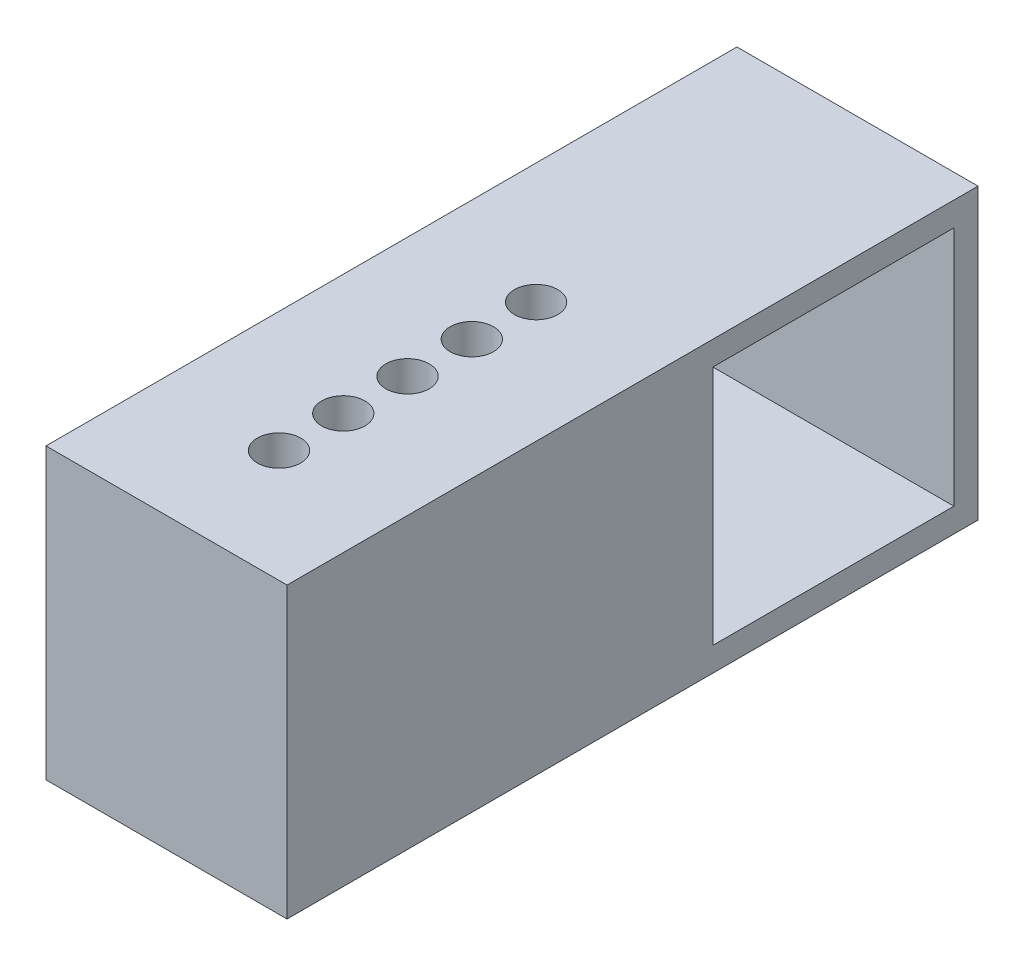
from build123d import *

# Parameters (mm, degrees)
SCHIZZO1_W                    = 25
SCHIZZO1_H                    = 18
SCHIZZO1_W_2                  = 18
SCHIZZO1_W_3                  = 15
SCHIZZO1_H_2                  = 15
ESTRUSIONE_ESTRUSIONE1_DEPTH  = 15
TAGLIO_ESTRUSIONE1_DEPTH      = 42.291645644
TAGLIO_ESTRUSIONE1_DEPTH_BACK = 42.291645644
SCHIZZO2_R                    = 1.35
SCHIZZO3_R                    = 1.35
TAGLIO_ESTRUSIONE2_DEPTH      = 15
SCHIZZO4_R                    = 1.35
TAGLIO_ESTRUSIONE3_DEPTH      = 15


with BuildPart() as part:
    # Schizzo1 → Estrusione-Estrusione1 (new body)
    # profile 1 of 2: a face of its own
    with BuildSketch(Plane(origin=(0, 0, 0), x_dir=(0, 0, -1), z_dir=(1, 0, 0))):
        with Locations((-21.5, 0)):
            Rectangle(SCHIZZO1_W, SCHIZZO1_H)
    # profile 2 of 2: a face of its own
    with BuildSketch(Plane(origin=(0, 0, 0), x_dir=(0, 0, -1), z_dir=(1, 0, 0))):
        Rectangle(SCHIZZO1_W_2, SCHIZZO1_H)
        Rectangle(SCHIZZO1_W_3, SCHIZZO1_H_2, mode=Mode.SUBTRACT)
    extrude(amount=ESTRUSIONE_ESTRUSIONE1_DEPTH)

    # Schizzo2 → Taglio-Estrusione1 (cut, two sides: drawn at the far end of the back side and taken through both)
    with BuildSketch(Plane(origin=(0, 9, 0), x_dir=(1, 0, 0), z_dir=(0, 1, 0)).offset(-TAGLIO_ESTRUSIONE1_DEPTH_BACK)):
        with Locations(Location((7.5, -27, 0), (0, 0, 270))):
            Circle(SCHIZZO2_R)
        with Locations(Location((7.5, -23, 0), (0, 0, 270))):
            Circle(SCHIZZO2_R)
        with Locations(Location((7.5, -19, 0), (0, 0, 270))):
            Circle(SCHIZZO2_R)
        with Locations(Location((7.5, -15, 0), (0, 0, 270))):
            Circle(SCHIZZO2_R)
    extrude(amount=TAGLIO_ESTRUSIONE1_DEPTH + TAGLIO_ESTRUSIONE1_DEPTH_BACK, mode=Mode.SUBTRACT)

    # Schizzo3 → Taglio-Estrusione2 (cut)
    with BuildSketch(Plane(origin=(0, 9, 0), x_dir=(1, 0, 0), z_dir=(0, 1, 0))):
        with Locations(Location((7.5, -11, 0), (0, 0, 270))):
            Circle(SCHIZZO3_R)
    extrude(amount=-TAGLIO_ESTRUSIONE2_DEPTH, mode=Mode.SUBTRACT)

    # Schizzo4 → Taglio-Estrusione3 (cut)
    with BuildSketch(Plane.XZ.offset(9)):
        with Locations(Location((7.5, 31, 0), (0, 0, 270))):
            Circle(SCHIZZO4_R)
    extrude(amount=-TAGLIO_ESTRUSIONE3_DEPTH, mode=Mode.SUBTRACT)


solid = part.part
